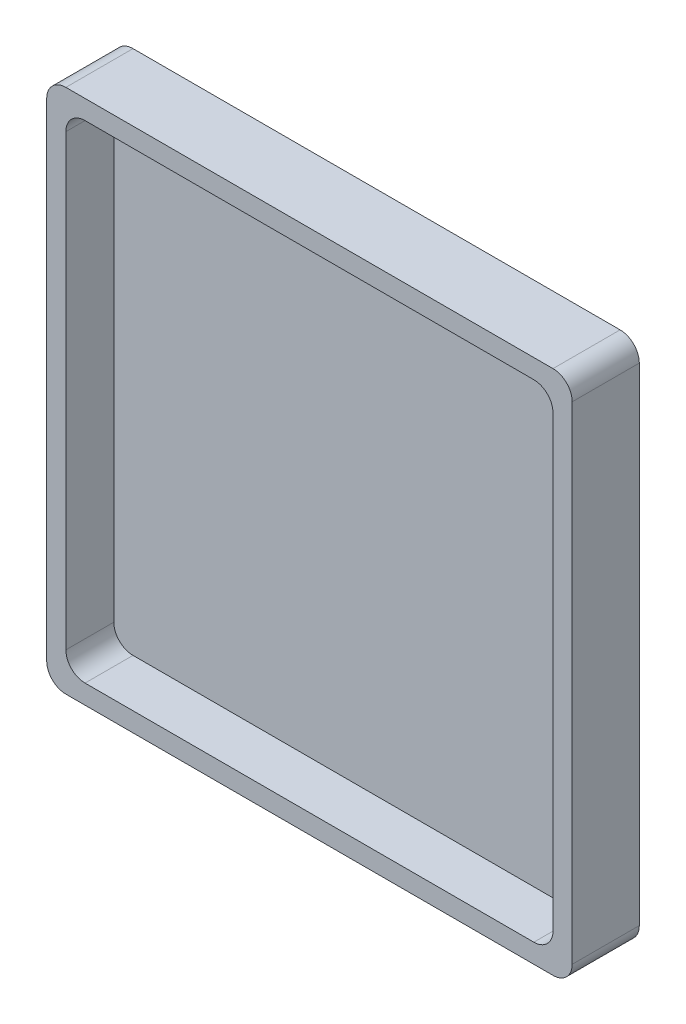
from build123d import *

# Parameters (mm, degrees)
SKETCH1_W           = 54.8
SKETCH1_H           = 54.8
SKETCH1_W_2         = 50.8
SKETCH1_H_2         = 50.8
BOSS_EXTRUDE1_DEPTH = 2
SKETCH2_W           = 54.8
SKETCH2_H           = 54.8
SKETCH2_W_2         = 50.8
SKETCH2_H_2         = 50.8
BOSS_EXTRUDE2_DEPTH = 5
FILLET1_R           = 2


with BuildPart() as part:
    # Sketch1 → Boss-Extrude1 (new body)
    # profile 1 of 2: a face of its own
    with BuildSketch(Plane.XY):
        Rectangle(SKETCH1_W, SKETCH1_H)
        Rectangle(SKETCH1_W_2, SKETCH1_H_2, mode=Mode.SUBTRACT)
    # profile 2 of 2: a face of its own
    with BuildSketch(Plane.XY):
        Rectangle(SKETCH1_W_2, SKETCH1_H_2)
    extrude(amount=BOSS_EXTRUDE1_DEPTH)

    # Sketch2 → Boss-Extrude2 (add)
    with BuildSketch(Plane.XY.offset(2)):
        Rectangle(SKETCH2_W, SKETCH2_H)
        Rectangle(SKETCH2_W_2, SKETCH2_H_2, mode=Mode.SUBTRACT)
    extrude(amount=BOSS_EXTRUDE2_DEPTH)

    # Fillet1
    fillet1_edges = [part.edges().sort_by_distance(p)[0] for p in [
        (-25.4, -25.4, 4.5),
        (25.4, -25.4, 4.5),
        (25.4, 25.4, 4.5),
        (-25.4, 25.4, 4.5),
        (27.4, 27.4, 3.5),
        (27.4, -27.4, 3.5),
        (-27.4, -27.4, 3.5),
        (-27.4, 27.4, 3.5),
    ]]
    fillet(fillet1_edges, radius=FILLET1_R)


solid = part.part
